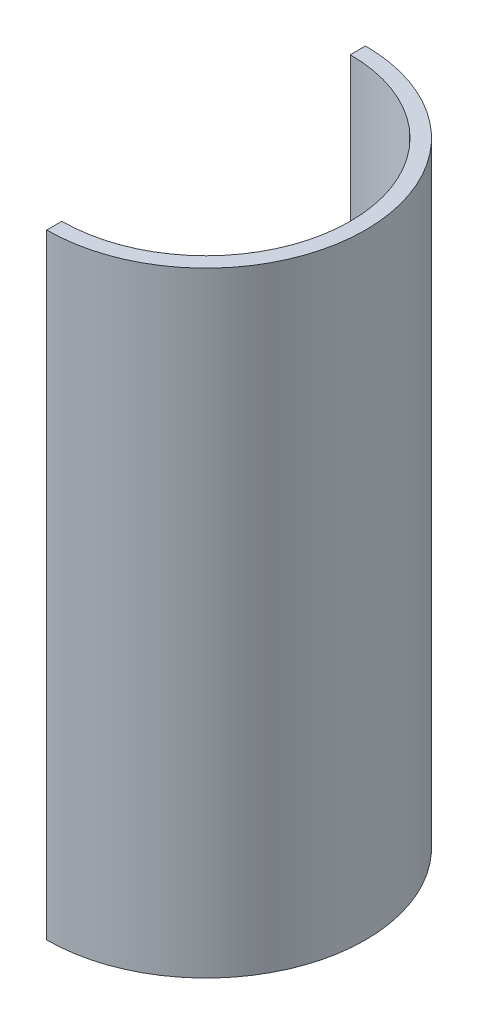
from build123d import *

# Parameters (mm, degrees)
SKETCH1_R           = 10.5
BOSS_EXTRUDE1_DEPTH = 40.5
SKETCH2_W           = 41.275373403
SKETCH2_H           = 50.56233242
CUT_EXTRUDE1_DEPTH  = 40.5
SHELL3_T            = -1


with BuildPart() as part:
    # Sketch1 → Boss-Extrude1 (new body)
    with BuildSketch(Plane(origin=(0, 0, 0), x_dir=(1, 0, 0), z_dir=(0, 1, 0))):
        with Locations(Location((0, 0, 0), (0, 0, 270))):
            Circle(SKETCH1_R)
    extrude(amount=BOSS_EXTRUDE1_DEPTH)

    # Sketch2 → Cut-Extrude1 (cut)
    with BuildSketch(Plane(origin=(0, 0, 0), x_dir=(0, 0, -1), z_dir=(1, 0, 0))):
        with Locations((2.800828909, 23.566771077)):
            Rectangle(SKETCH2_W, SKETCH2_H)
    extrude(amount=-CUT_EXTRUDE1_DEPTH, mode=Mode.SUBTRACT)

    # Shell3
    shell3_openings = [part.faces().sort_by_distance(p)[0] for p in [
        (4.456338407, 40.5, 0),
        (0, 20.25, 0),
    ]]
    offset(amount=SHELL3_T, openings=shell3_openings)


solid = part.part
